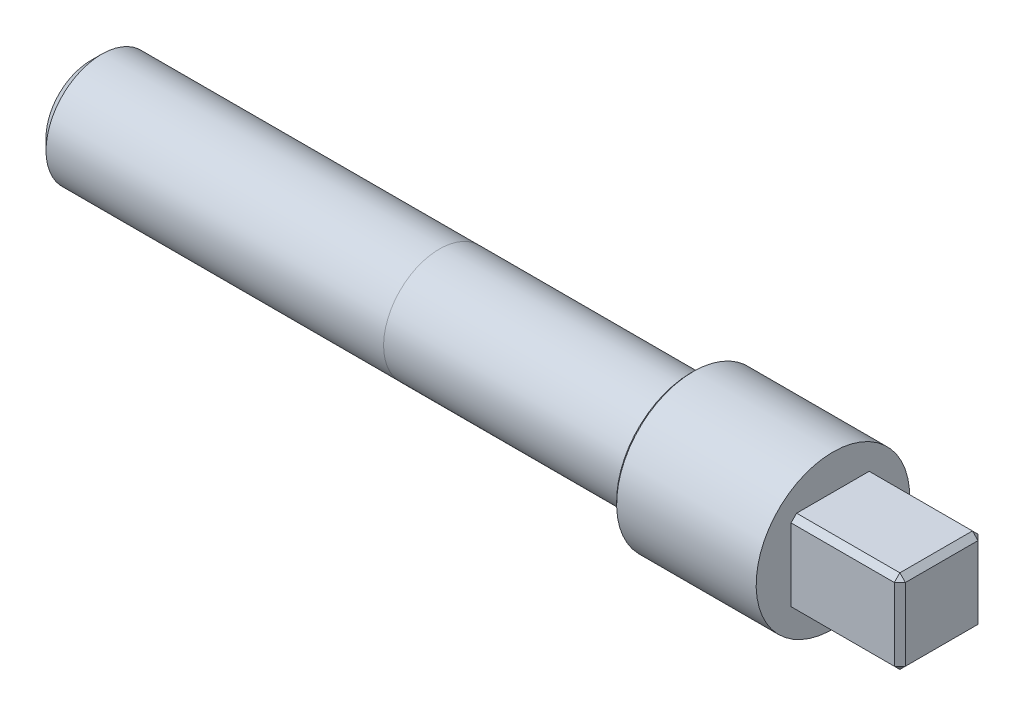
from build123d import *

# Parameters (mm, degrees)
SKETCH_1_R          = 20
EXTRUDE_1_DEPTH     = 215
SKETCH_2_R          = 27.5
EXTRUDE_2_DEPTH     = 51
SKETCH_3_W          = 30
SKETCH_3_H          = 30
EXTRUDE_3_DEPTH     = 39
CHAMFER_2_SIZE      = 1
CHAMFER_3_SIZE      = 2
SKETCH_4_R          = 20
SKETCH_4_R_2        = 19.975
CUT_EXTRUDE_1_DEPTH = 125
CHAMFER_4_SIZE      = 4


with BuildPart() as part:
    # 草图1 → 凸台-拉伸1 (new body)
    with BuildSketch(Plane(origin=(0, 0, 0), x_dir=(0, -1, 0), z_dir=(1, 0, 0))):
        with Locations(Location((0, 0, 0), (0, 0, 90))):
            Circle(SKETCH_1_R)
    extrude(amount=EXTRUDE_1_DEPTH)

    # 草图2 → 凸台-拉伸2 (add)
    with BuildSketch(Plane(origin=(215, 0, 0), x_dir=(0, -1, 0), z_dir=(1, 0, 0))):
        with Locations(Location((0, 0, 0), (0, 0, 180))):
            Circle(SKETCH_2_R)
    extrude(amount=EXTRUDE_2_DEPTH)

    # 草图3 → 凸台-拉伸3 (add)
    with BuildSketch(Plane(origin=(266, 0, 0), x_dir=(0, -1, 0), z_dir=(1, 0, 0))):
        Rectangle(SKETCH_3_W, SKETCH_3_H)
    extrude(amount=EXTRUDE_3_DEPTH)

    # 倒角2
    chamfer_2_edges = [part.edges().sort_by_distance(p)[0] for p in [
        (215, -27.5, 0),
    ]]
    chamfer(chamfer_2_edges, length=CHAMFER_2_SIZE)

    # 倒角3
    chamfer_3_edges = [part.edges().sort_by_distance(p)[0] for p in [
        (285.5, 15, -15),
        (285.5, 15, 15),
        (285.5, -15, 15),
        (285.5, -15, -15),
        (305, 15, 0),
        (305, 0, 15),
        (305, -15, 0),
        (305, 0, -15),
    ]]
    chamfer(chamfer_3_edges, length=CHAMFER_3_SIZE)

    # 草图4 → 切除-拉伸1 (cut)
    with BuildSketch(Plane(origin=(0, 0, 0), x_dir=(0, -1, 0), z_dir=(-1, 0, 0))):
        Circle(SKETCH_4_R)
        Circle(SKETCH_4_R_2, mode=Mode.SUBTRACT)
    extrude(amount=-CUT_EXTRUDE_1_DEPTH, mode=Mode.SUBTRACT)

    # 倒角4
    chamfer_4_edges = [part.edges().sort_by_distance(p)[0] for p in [
        (0, 19.975, 0),
    ]]
    chamfer(chamfer_4_edges, length=CHAMFER_4_SIZE)


solid = part.part
